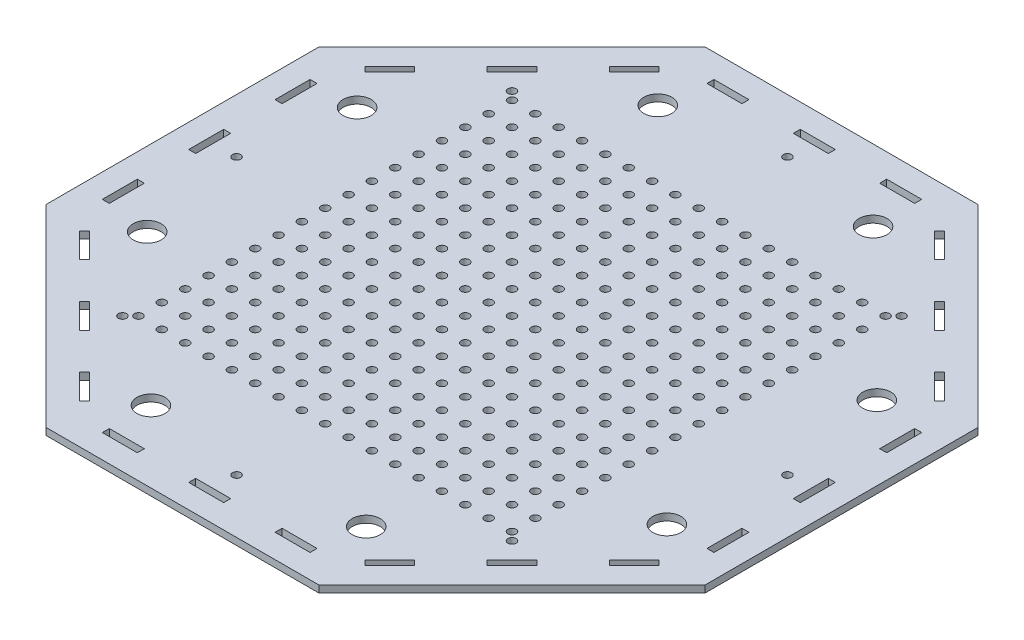
from build123d import *

# Parameters (mm, degrees)
EXTRUDE_1_DEPTH      = 1.5
EXTRUDE_1_DEPTH_BACK = 1.5
SKETCH_1_R           = 1.75
SKETCH_1_W           = 15
SKETCH_1_H           = 3
SKETCH_1_R_2         = 6
SKETCH_1_W_2         = 3
SKETCH_1_H_2         = 15


with BuildPart() as part:
    # Эскиз1 → Бобышка-Вытянуть1 (new, two sides: drawn at the far end of the back side and taken through both)
    with BuildSketch(Plane(origin=(0, 0, 0), x_dir=(1, 0, 0), z_dir=(0, 1, 0)).offset(-EXTRUDE_1_DEPTH_BACK)):
        Polygon((58.465821511, -141.148979228), (141.148979228, -58.465821511), (141.148979228, 58.465821511), (58.465821511, 141.148979228), (-58.465821511, 141.148979228), (-141.148979228, 58.465821511), (-141.148979228, -58.465821511), (-58.465821511, -141.148979228), align=None)
        Polygon((-95.812968851, -85.206367133), (-85.206367133, -95.812968851), (-87.327687476, -97.934289194), (-97.934289194, -87.327687476), (-96.873629023, -86.267027305), align=None, mode=Mode.SUBTRACT)
        with Locations((-83.43860018, -83.43860018)):
            Circle(SKETCH_1_R, mode=Mode.SUBTRACT)
        with Locations((-80, -80)):
            Circle(SKETCH_1_R, mode=Mode.SUBTRACT)
        with Locations((-37, -129.5)):
            Rectangle(SKETCH_1_W, SKETCH_1_H, mode=Mode.SUBTRACT)
        Polygon((-69.650017947, -111.369318037), (-59.043416229, -121.975919755), (-61.164736573, -124.097240098), (-71.771338291, -113.49063838), align=None, mode=Mode.SUBTRACT)
        with Locations((-44.154662613, -110.505048615)):
            Circle(SKETCH_1_R_2, mode=Mode.SUBTRACT)
        with Locations((-70, -80)):
            Circle(SKETCH_1_R, mode=Mode.SUBTRACT)
        with Locations((-60, -80)):
            Circle(SKETCH_1_R, mode=Mode.SUBTRACT)
        with Locations((-50, -80)):
            Circle(SKETCH_1_R, mode=Mode.SUBTRACT)
        with Locations((-40, -80)):
            Circle(SKETCH_1_R, mode=Mode.SUBTRACT)
        with Locations((-30, -80)):
            Circle(SKETCH_1_R, mode=Mode.SUBTRACT)
        with Locations((-20, -80)):
            Circle(SKETCH_1_R, mode=Mode.SUBTRACT)
        with Locations((-10, -80)):
            Circle(SKETCH_1_R, mode=Mode.SUBTRACT)
        Polygon((-124.097240098, -61.164736573), (-121.975919755, -59.043416229), (-111.369318037, -69.650017947), (-113.49063838, -71.771338291), align=None, mode=Mode.SUBTRACT)
        with Locations((-129.5, -37)):
            Rectangle(SKETCH_1_W_2, SKETCH_1_H_2, mode=Mode.SUBTRACT)
        with Locations((-109.360930586, -46.916807876)):
            Circle(SKETCH_1_R_2, mode=Mode.SUBTRACT)
        with Locations((-80, -70)):
            Circle(SKETCH_1_R, mode=Mode.SUBTRACT)
        with Locations((-80, -60)):
            Circle(SKETCH_1_R, mode=Mode.SUBTRACT)
        with Locations((-80, -50)):
            Circle(SKETCH_1_R, mode=Mode.SUBTRACT)
        with Locations((-80, -40)):
            Circle(SKETCH_1_R, mode=Mode.SUBTRACT)
        Polygon((-128, 7.5), (-128, -7.5), (-131, -7.5), (-131, 7.5), (-129.5, 7.5), align=None, mode=Mode.SUBTRACT)
        with Locations((-118, 0)):
            Circle(SKETCH_1_R, mode=Mode.SUBTRACT)
        with Locations((-80, -30)):
            Circle(SKETCH_1_R, mode=Mode.SUBTRACT)
        with Locations((-80, -20)):
            Circle(SKETCH_1_R, mode=Mode.SUBTRACT)
        with Locations((-80, -10)):
            Circle(SKETCH_1_R, mode=Mode.SUBTRACT)
        with Locations((-80, 0)):
            Circle(SKETCH_1_R, mode=Mode.SUBTRACT)
        with Locations((-70, -70)):
            Circle(SKETCH_1_R, mode=Mode.SUBTRACT)
        with Locations((-60, -70)):
            Circle(SKETCH_1_R, mode=Mode.SUBTRACT)
        with Locations((-70, -60)):
            Circle(SKETCH_1_R, mode=Mode.SUBTRACT)
        with Locations((-60, -60)):
            Circle(SKETCH_1_R, mode=Mode.SUBTRACT)
        with Locations((-50, -70)):
            Circle(SKETCH_1_R, mode=Mode.SUBTRACT)
        with Locations((-40, -70)):
            Circle(SKETCH_1_R, mode=Mode.SUBTRACT)
        with Locations((-50, -60)):
            Circle(SKETCH_1_R, mode=Mode.SUBTRACT)
        with Locations((-40, -60)):
            Circle(SKETCH_1_R, mode=Mode.SUBTRACT)
        with Locations((-70, -50)):
            Circle(SKETCH_1_R, mode=Mode.SUBTRACT)
        with Locations((-60, -50)):
            Circle(SKETCH_1_R, mode=Mode.SUBTRACT)
        with Locations((-70, -40)):
            Circle(SKETCH_1_R, mode=Mode.SUBTRACT)
        with Locations((-60, -40)):
            Circle(SKETCH_1_R, mode=Mode.SUBTRACT)
        with Locations((-50, -50)):
            Circle(SKETCH_1_R, mode=Mode.SUBTRACT)
        with Locations((-40, -50)):
            Circle(SKETCH_1_R, mode=Mode.SUBTRACT)
        with Locations((-50, -40)):
            Circle(SKETCH_1_R, mode=Mode.SUBTRACT)
        with Locations((-40, -40)):
            Circle(SKETCH_1_R, mode=Mode.SUBTRACT)
        with Locations((-30, -70)):
            Circle(SKETCH_1_R, mode=Mode.SUBTRACT)
        with Locations((-20, -70)):
            Circle(SKETCH_1_R, mode=Mode.SUBTRACT)
        with Locations((-30, -60)):
            Circle(SKETCH_1_R, mode=Mode.SUBTRACT)
        with Locations((-20, -60)):
            Circle(SKETCH_1_R, mode=Mode.SUBTRACT)
        with Locations((-10, -70)):
            Circle(SKETCH_1_R, mode=Mode.SUBTRACT)
        with Locations((-10, -60)):
            Circle(SKETCH_1_R, mode=Mode.SUBTRACT)
        with Locations((-30, -50)):
            Circle(SKETCH_1_R, mode=Mode.SUBTRACT)
        with Locations((-20, -50)):
            Circle(SKETCH_1_R, mode=Mode.SUBTRACT)
        with Locations((-30, -40)):
            Circle(SKETCH_1_R, mode=Mode.SUBTRACT)
        with Locations((-20, -40)):
            Circle(SKETCH_1_R, mode=Mode.SUBTRACT)
        with Locations((-10, -50)):
            Circle(SKETCH_1_R, mode=Mode.SUBTRACT)
        with Locations((-10, -40)):
            Circle(SKETCH_1_R, mode=Mode.SUBTRACT)
        with Locations((-70, -30)):
            Circle(SKETCH_1_R, mode=Mode.SUBTRACT)
        with Locations((-60, -30)):
            Circle(SKETCH_1_R, mode=Mode.SUBTRACT)
        with Locations((-70, -20)):
            Circle(SKETCH_1_R, mode=Mode.SUBTRACT)
        with Locations((-60, -20)):
            Circle(SKETCH_1_R, mode=Mode.SUBTRACT)
        with Locations((-50, -30)):
            Circle(SKETCH_1_R, mode=Mode.SUBTRACT)
        with Locations((-40, -30)):
            Circle(SKETCH_1_R, mode=Mode.SUBTRACT)
        with Locations((-50, -20)):
            Circle(SKETCH_1_R, mode=Mode.SUBTRACT)
        with Locations((-40, -20)):
            Circle(SKETCH_1_R, mode=Mode.SUBTRACT)
        with Locations((-70, -10)):
            Circle(SKETCH_1_R, mode=Mode.SUBTRACT)
        with Locations((-60, -10)):
            Circle(SKETCH_1_R, mode=Mode.SUBTRACT)
        with Locations((-70, 0)):
            Circle(SKETCH_1_R, mode=Mode.SUBTRACT)
        with Locations((-60, 0)):
            Circle(SKETCH_1_R, mode=Mode.SUBTRACT)
        with Locations((-50, -10)):
            Circle(SKETCH_1_R, mode=Mode.SUBTRACT)
        with Locations((-40, -10)):
            Circle(SKETCH_1_R, mode=Mode.SUBTRACT)
        with Locations((-50, 0)):
            Circle(SKETCH_1_R, mode=Mode.SUBTRACT)
        with Locations((-40, 0)):
            Circle(SKETCH_1_R, mode=Mode.SUBTRACT)
        with Locations((-30, -30)):
            Circle(SKETCH_1_R, mode=Mode.SUBTRACT)
        with Locations((-20, -30)):
            Circle(SKETCH_1_R, mode=Mode.SUBTRACT)
        with Locations((-30, -20)):
            Circle(SKETCH_1_R, mode=Mode.SUBTRACT)
        with Locations((-20, -20)):
            Circle(SKETCH_1_R, mode=Mode.SUBTRACT)
        with Locations((-10, -30)):
            Circle(SKETCH_1_R, mode=Mode.SUBTRACT)
        with Locations((-10, -20)):
            Circle(SKETCH_1_R, mode=Mode.SUBTRACT)
        with Locations((-30, -10)):
            Circle(SKETCH_1_R, mode=Mode.SUBTRACT)
        with Locations((-20, -10)):
            Circle(SKETCH_1_R, mode=Mode.SUBTRACT)
        with Locations((-30, 0)):
            Circle(SKETCH_1_R, mode=Mode.SUBTRACT)
        with Locations((-20, 0)):
            Circle(SKETCH_1_R, mode=Mode.SUBTRACT)
        with Locations((-10, -10)):
            Circle(SKETCH_1_R, mode=Mode.SUBTRACT)
        with Locations((-10, 0)):
            Circle(SKETCH_1_R, mode=Mode.SUBTRACT)
        Polygon((-7.5, -128), (7.5, -128), (7.5, -131), (-7.5, -131), (-7.5, -129.5), align=None, mode=Mode.SUBTRACT)
        with Locations((0, -118)):
            Circle(SKETCH_1_R, mode=Mode.SUBTRACT)
        with Locations((37, -129.5)):
            Rectangle(SKETCH_1_W, SKETCH_1_H, mode=Mode.SUBTRACT)
        with Locations((46.916807876, -109.360930586)):
            Circle(SKETCH_1_R_2, mode=Mode.SUBTRACT)
        Polygon((61.164736573, -124.097240098), (59.043416229, -121.975919755), (69.650017947, -111.369318037), (71.771338291, -113.49063838), align=None, mode=Mode.SUBTRACT)
        with Locations((0, -80)):
            Circle(SKETCH_1_R, mode=Mode.SUBTRACT)
        with Locations((10, -80)):
            Circle(SKETCH_1_R, mode=Mode.SUBTRACT)
        with Locations((20, -80)):
            Circle(SKETCH_1_R, mode=Mode.SUBTRACT)
        with Locations((30, -80)):
            Circle(SKETCH_1_R, mode=Mode.SUBTRACT)
        with Locations((40, -80)):
            Circle(SKETCH_1_R, mode=Mode.SUBTRACT)
        with Locations((50, -80)):
            Circle(SKETCH_1_R, mode=Mode.SUBTRACT)
        with Locations((60, -80)):
            Circle(SKETCH_1_R, mode=Mode.SUBTRACT)
        with Locations((70, -80)):
            Circle(SKETCH_1_R, mode=Mode.SUBTRACT)
        Polygon((85.206367133, -95.812968851), (95.812968851, -85.206367133), (97.934289194, -87.327687476), (87.327687476, -97.934289194), (86.267027305, -96.873629023), align=None, mode=Mode.SUBTRACT)
        with Locations((83.43860018, -83.43860018)):
            Circle(SKETCH_1_R, mode=Mode.SUBTRACT)
        with Locations((80, -80)):
            Circle(SKETCH_1_R, mode=Mode.SUBTRACT)
        with Locations((0, -70)):
            Circle(SKETCH_1_R, mode=Mode.SUBTRACT)
        with Locations((10, -70)):
            Circle(SKETCH_1_R, mode=Mode.SUBTRACT)
        with Locations((0, -60)):
            Circle(SKETCH_1_R, mode=Mode.SUBTRACT)
        with Locations((10, -60)):
            Circle(SKETCH_1_R, mode=Mode.SUBTRACT)
        with Locations((20, -70)):
            Circle(SKETCH_1_R, mode=Mode.SUBTRACT)
        with Locations((30, -70)):
            Circle(SKETCH_1_R, mode=Mode.SUBTRACT)
        with Locations((20, -60)):
            Circle(SKETCH_1_R, mode=Mode.SUBTRACT)
        with Locations((30, -60)):
            Circle(SKETCH_1_R, mode=Mode.SUBTRACT)
        with Locations((0, -50)):
            Circle(SKETCH_1_R, mode=Mode.SUBTRACT)
        with Locations((10, -50)):
            Circle(SKETCH_1_R, mode=Mode.SUBTRACT)
        with Locations((0, -40)):
            Circle(SKETCH_1_R, mode=Mode.SUBTRACT)
        with Locations((10, -40)):
            Circle(SKETCH_1_R, mode=Mode.SUBTRACT)
        with Locations((20, -50)):
            Circle(SKETCH_1_R, mode=Mode.SUBTRACT)
        with Locations((30, -50)):
            Circle(SKETCH_1_R, mode=Mode.SUBTRACT)
        with Locations((20, -40)):
            Circle(SKETCH_1_R, mode=Mode.SUBTRACT)
        with Locations((30, -40)):
            Circle(SKETCH_1_R, mode=Mode.SUBTRACT)
        with Locations((40, -70)):
            Circle(SKETCH_1_R, mode=Mode.SUBTRACT)
        with Locations((50, -70)):
            Circle(SKETCH_1_R, mode=Mode.SUBTRACT)
        with Locations((40, -60)):
            Circle(SKETCH_1_R, mode=Mode.SUBTRACT)
        with Locations((50, -60)):
            Circle(SKETCH_1_R, mode=Mode.SUBTRACT)
        with Locations((60, -70)):
            Circle(SKETCH_1_R, mode=Mode.SUBTRACT)
        with Locations((70, -70)):
            Circle(SKETCH_1_R, mode=Mode.SUBTRACT)
        with Locations((60, -60)):
            Circle(SKETCH_1_R, mode=Mode.SUBTRACT)
        with Locations((70, -60)):
            Circle(SKETCH_1_R, mode=Mode.SUBTRACT)
        with Locations((40, -50)):
            Circle(SKETCH_1_R, mode=Mode.SUBTRACT)
        with Locations((50, -50)):
            Circle(SKETCH_1_R, mode=Mode.SUBTRACT)
        with Locations((40, -40)):
            Circle(SKETCH_1_R, mode=Mode.SUBTRACT)
        with Locations((50, -40)):
            Circle(SKETCH_1_R, mode=Mode.SUBTRACT)
        with Locations((60, -50)):
            Circle(SKETCH_1_R, mode=Mode.SUBTRACT)
        with Locations((70, -50)):
            Circle(SKETCH_1_R, mode=Mode.SUBTRACT)
        with Locations((60, -40)):
            Circle(SKETCH_1_R, mode=Mode.SUBTRACT)
        with Locations((70, -40)):
            Circle(SKETCH_1_R, mode=Mode.SUBTRACT)
        with Locations((0, -30)):
            Circle(SKETCH_1_R, mode=Mode.SUBTRACT)
        with Locations((10, -30)):
            Circle(SKETCH_1_R, mode=Mode.SUBTRACT)
        with Locations((0, -20)):
            Circle(SKETCH_1_R, mode=Mode.SUBTRACT)
        with Locations((10, -20)):
            Circle(SKETCH_1_R, mode=Mode.SUBTRACT)
        with Locations((20, -30)):
            Circle(SKETCH_1_R, mode=Mode.SUBTRACT)
        with Locations((30, -30)):
            Circle(SKETCH_1_R, mode=Mode.SUBTRACT)
        with Locations((20, -20)):
            Circle(SKETCH_1_R, mode=Mode.SUBTRACT)
        with Locations((30, -20)):
            Circle(SKETCH_1_R, mode=Mode.SUBTRACT)
        with Locations((0, -10)):
            Circle(SKETCH_1_R, mode=Mode.SUBTRACT)
        with Locations((10, -10)):
            Circle(SKETCH_1_R, mode=Mode.SUBTRACT)
        with Locations((20, -10)):
            Circle(SKETCH_1_R, mode=Mode.SUBTRACT)
        with Locations((30, -10)):
            Circle(SKETCH_1_R, mode=Mode.SUBTRACT)
        with Locations((40, -30)):
            Circle(SKETCH_1_R, mode=Mode.SUBTRACT)
        with Locations((50, -30)):
            Circle(SKETCH_1_R, mode=Mode.SUBTRACT)
        with Locations((40, -20)):
            Circle(SKETCH_1_R, mode=Mode.SUBTRACT)
        with Locations((50, -20)):
            Circle(SKETCH_1_R, mode=Mode.SUBTRACT)
        with Locations((60, -30)):
            Circle(SKETCH_1_R, mode=Mode.SUBTRACT)
        with Locations((70, -30)):
            Circle(SKETCH_1_R, mode=Mode.SUBTRACT)
        with Locations((60, -20)):
            Circle(SKETCH_1_R, mode=Mode.SUBTRACT)
        with Locations((70, -20)):
            Circle(SKETCH_1_R, mode=Mode.SUBTRACT)
        with Locations((40, -10)):
            Circle(SKETCH_1_R, mode=Mode.SUBTRACT)
        with Locations((50, -10)):
            Circle(SKETCH_1_R, mode=Mode.SUBTRACT)
        with Locations((60, -10)):
            Circle(SKETCH_1_R, mode=Mode.SUBTRACT)
        with Locations((70, -10)):
            Circle(SKETCH_1_R, mode=Mode.SUBTRACT)
        with Locations((80, -70)):
            Circle(SKETCH_1_R, mode=Mode.SUBTRACT)
        with Locations((80, -60)):
            Circle(SKETCH_1_R, mode=Mode.SUBTRACT)
        with Locations((80, -50)):
            Circle(SKETCH_1_R, mode=Mode.SUBTRACT)
        with Locations((80, -40)):
            Circle(SKETCH_1_R, mode=Mode.SUBTRACT)
        Polygon((111.369318037, -69.650017947), (121.975919755, -59.043416229), (124.097240098, -61.164736573), (113.49063838, -71.771338291), align=None, mode=Mode.SUBTRACT)
        with Locations((110.505048615, -44.154662613)):
            Circle(SKETCH_1_R_2, mode=Mode.SUBTRACT)
        with Locations((129.5, -37)):
            Rectangle(SKETCH_1_W_2, SKETCH_1_H_2, mode=Mode.SUBTRACT)
        with Locations((80, -30)):
            Circle(SKETCH_1_R, mode=Mode.SUBTRACT)
        with Locations((80, -20)):
            Circle(SKETCH_1_R, mode=Mode.SUBTRACT)
        with Locations((80, -10)):
            Circle(SKETCH_1_R, mode=Mode.SUBTRACT)
        with Locations((-80, 10)):
            Circle(SKETCH_1_R, mode=Mode.SUBTRACT)
        with Locations((-80, 20)):
            Circle(SKETCH_1_R, mode=Mode.SUBTRACT)
        with Locations((-80, 30)):
            Circle(SKETCH_1_R, mode=Mode.SUBTRACT)
        with Locations((-129.5, 37)):
            Rectangle(SKETCH_1_W_2, SKETCH_1_H_2, mode=Mode.SUBTRACT)
        with Locations((-110.505048615, 44.154662613)):
            Circle(SKETCH_1_R_2, mode=Mode.SUBTRACT)
        Polygon((-111.369318037, 69.650017947), (-121.975919755, 59.043416229), (-124.097240098, 61.164736573), (-113.49063838, 71.771338291), align=None, mode=Mode.SUBTRACT)
        with Locations((-80, 40)):
            Circle(SKETCH_1_R, mode=Mode.SUBTRACT)
        with Locations((-80, 50)):
            Circle(SKETCH_1_R, mode=Mode.SUBTRACT)
        with Locations((-80, 60)):
            Circle(SKETCH_1_R, mode=Mode.SUBTRACT)
        with Locations((-80, 70)):
            Circle(SKETCH_1_R, mode=Mode.SUBTRACT)
        with Locations((-70, 10)):
            Circle(SKETCH_1_R, mode=Mode.SUBTRACT)
        with Locations((-60, 10)):
            Circle(SKETCH_1_R, mode=Mode.SUBTRACT)
        with Locations((-50, 10)):
            Circle(SKETCH_1_R, mode=Mode.SUBTRACT)
        with Locations((-40, 10)):
            Circle(SKETCH_1_R, mode=Mode.SUBTRACT)
        with Locations((-70, 20)):
            Circle(SKETCH_1_R, mode=Mode.SUBTRACT)
        with Locations((-60, 20)):
            Circle(SKETCH_1_R, mode=Mode.SUBTRACT)
        with Locations((-70, 30)):
            Circle(SKETCH_1_R, mode=Mode.SUBTRACT)
        with Locations((-60, 30)):
            Circle(SKETCH_1_R, mode=Mode.SUBTRACT)
        with Locations((-50, 20)):
            Circle(SKETCH_1_R, mode=Mode.SUBTRACT)
        with Locations((-40, 20)):
            Circle(SKETCH_1_R, mode=Mode.SUBTRACT)
        with Locations((-50, 30)):
            Circle(SKETCH_1_R, mode=Mode.SUBTRACT)
        with Locations((-40, 30)):
            Circle(SKETCH_1_R, mode=Mode.SUBTRACT)
        with Locations((-30, 10)):
            Circle(SKETCH_1_R, mode=Mode.SUBTRACT)
        with Locations((-20, 10)):
            Circle(SKETCH_1_R, mode=Mode.SUBTRACT)
        Circle(SKETCH_1_R, mode=Mode.SUBTRACT)
        with Locations((-10, 10)):
            Circle(SKETCH_1_R, mode=Mode.SUBTRACT)
        with Locations((0, 10)):
            Circle(SKETCH_1_R, mode=Mode.SUBTRACT)
        with Locations((-30, 20)):
            Circle(SKETCH_1_R, mode=Mode.SUBTRACT)
        with Locations((-20, 20)):
            Circle(SKETCH_1_R, mode=Mode.SUBTRACT)
        with Locations((-30, 30)):
            Circle(SKETCH_1_R, mode=Mode.SUBTRACT)
        with Locations((-20, 30)):
            Circle(SKETCH_1_R, mode=Mode.SUBTRACT)
        with Locations((-10, 20)):
            Circle(SKETCH_1_R, mode=Mode.SUBTRACT)
        with Locations((0, 20)):
            Circle(SKETCH_1_R, mode=Mode.SUBTRACT)
        with Locations((-10, 30)):
            Circle(SKETCH_1_R, mode=Mode.SUBTRACT)
        with Locations((0, 30)):
            Circle(SKETCH_1_R, mode=Mode.SUBTRACT)
        with Locations((-70, 40)):
            Circle(SKETCH_1_R, mode=Mode.SUBTRACT)
        with Locations((-60, 40)):
            Circle(SKETCH_1_R, mode=Mode.SUBTRACT)
        with Locations((-70, 50)):
            Circle(SKETCH_1_R, mode=Mode.SUBTRACT)
        with Locations((-60, 50)):
            Circle(SKETCH_1_R, mode=Mode.SUBTRACT)
        with Locations((-50, 40)):
            Circle(SKETCH_1_R, mode=Mode.SUBTRACT)
        with Locations((-40, 40)):
            Circle(SKETCH_1_R, mode=Mode.SUBTRACT)
        with Locations((-50, 50)):
            Circle(SKETCH_1_R, mode=Mode.SUBTRACT)
        with Locations((-40, 50)):
            Circle(SKETCH_1_R, mode=Mode.SUBTRACT)
        with Locations((-70, 60)):
            Circle(SKETCH_1_R, mode=Mode.SUBTRACT)
        with Locations((-60, 60)):
            Circle(SKETCH_1_R, mode=Mode.SUBTRACT)
        with Locations((-70, 70)):
            Circle(SKETCH_1_R, mode=Mode.SUBTRACT)
        with Locations((-60, 70)):
            Circle(SKETCH_1_R, mode=Mode.SUBTRACT)
        with Locations((-50, 60)):
            Circle(SKETCH_1_R, mode=Mode.SUBTRACT)
        with Locations((-40, 60)):
            Circle(SKETCH_1_R, mode=Mode.SUBTRACT)
        with Locations((-50, 70)):
            Circle(SKETCH_1_R, mode=Mode.SUBTRACT)
        with Locations((-40, 70)):
            Circle(SKETCH_1_R, mode=Mode.SUBTRACT)
        with Locations((-30, 40)):
            Circle(SKETCH_1_R, mode=Mode.SUBTRACT)
        with Locations((-20, 40)):
            Circle(SKETCH_1_R, mode=Mode.SUBTRACT)
        with Locations((-30, 50)):
            Circle(SKETCH_1_R, mode=Mode.SUBTRACT)
        with Locations((-20, 50)):
            Circle(SKETCH_1_R, mode=Mode.SUBTRACT)
        with Locations((-10, 40)):
            Circle(SKETCH_1_R, mode=Mode.SUBTRACT)
        with Locations((0, 40)):
            Circle(SKETCH_1_R, mode=Mode.SUBTRACT)
        with Locations((-10, 50)):
            Circle(SKETCH_1_R, mode=Mode.SUBTRACT)
        with Locations((0, 50)):
            Circle(SKETCH_1_R, mode=Mode.SUBTRACT)
        with Locations((-30, 60)):
            Circle(SKETCH_1_R, mode=Mode.SUBTRACT)
        with Locations((-20, 60)):
            Circle(SKETCH_1_R, mode=Mode.SUBTRACT)
        with Locations((-30, 70)):
            Circle(SKETCH_1_R, mode=Mode.SUBTRACT)
        with Locations((-20, 70)):
            Circle(SKETCH_1_R, mode=Mode.SUBTRACT)
        with Locations((-10, 60)):
            Circle(SKETCH_1_R, mode=Mode.SUBTRACT)
        with Locations((0, 60)):
            Circle(SKETCH_1_R, mode=Mode.SUBTRACT)
        with Locations((-10, 70)):
            Circle(SKETCH_1_R, mode=Mode.SUBTRACT)
        with Locations((0, 70)):
            Circle(SKETCH_1_R, mode=Mode.SUBTRACT)
        with Locations((-80, 80)):
            Circle(SKETCH_1_R, mode=Mode.SUBTRACT)
        with Locations((-83.43860018, 83.43860018)):
            Circle(SKETCH_1_R, mode=Mode.SUBTRACT)
        Polygon((-85.206367133, 95.812968851), (-95.812968851, 85.206367133), (-97.934289194, 87.327687476), (-87.327687476, 97.934289194), (-86.267027305, 96.873629023), align=None, mode=Mode.SUBTRACT)
        with Locations((-70, 80)):
            Circle(SKETCH_1_R, mode=Mode.SUBTRACT)
        with Locations((-60, 80)):
            Circle(SKETCH_1_R, mode=Mode.SUBTRACT)
        with Locations((-50, 80)):
            Circle(SKETCH_1_R, mode=Mode.SUBTRACT)
        with Locations((-40, 80)):
            Circle(SKETCH_1_R, mode=Mode.SUBTRACT)
        with Locations((-30, 80)):
            Circle(SKETCH_1_R, mode=Mode.SUBTRACT)
        with Locations((-20, 80)):
            Circle(SKETCH_1_R, mode=Mode.SUBTRACT)
        with Locations((-10, 80)):
            Circle(SKETCH_1_R, mode=Mode.SUBTRACT)
        with Locations((0, 80)):
            Circle(SKETCH_1_R, mode=Mode.SUBTRACT)
        Polygon((-61.164736573, 124.097240098), (-59.043416229, 121.975919755), (-69.650017947, 111.369318037), (-71.771338291, 113.49063838), align=None, mode=Mode.SUBTRACT)
        with Locations((-46.916807876, 109.360930586)):
            Circle(SKETCH_1_R_2, mode=Mode.SUBTRACT)
        with Locations((-37, 129.5)):
            Rectangle(SKETCH_1_W, SKETCH_1_H, mode=Mode.SUBTRACT)
        with Locations((0, 118)):
            Circle(SKETCH_1_R, mode=Mode.SUBTRACT)
        Polygon((7.5, 128), (-7.5, 128), (-7.5, 131), (7.5, 131), (7.5, 129.5), align=None, mode=Mode.SUBTRACT)
        with Locations((10, 0)):
            Circle(SKETCH_1_R, mode=Mode.SUBTRACT)
        with Locations((10, 10)):
            Circle(SKETCH_1_R, mode=Mode.SUBTRACT)
        with Locations((20, 0)):
            Circle(SKETCH_1_R, mode=Mode.SUBTRACT)
        with Locations((30, 0)):
            Circle(SKETCH_1_R, mode=Mode.SUBTRACT)
        with Locations((20, 10)):
            Circle(SKETCH_1_R, mode=Mode.SUBTRACT)
        with Locations((30, 10)):
            Circle(SKETCH_1_R, mode=Mode.SUBTRACT)
        with Locations((10, 20)):
            Circle(SKETCH_1_R, mode=Mode.SUBTRACT)
        with Locations((10, 30)):
            Circle(SKETCH_1_R, mode=Mode.SUBTRACT)
        with Locations((20, 20)):
            Circle(SKETCH_1_R, mode=Mode.SUBTRACT)
        with Locations((30, 20)):
            Circle(SKETCH_1_R, mode=Mode.SUBTRACT)
        with Locations((20, 30)):
            Circle(SKETCH_1_R, mode=Mode.SUBTRACT)
        with Locations((30, 30)):
            Circle(SKETCH_1_R, mode=Mode.SUBTRACT)
        with Locations((40, 0)):
            Circle(SKETCH_1_R, mode=Mode.SUBTRACT)
        with Locations((50, 0)):
            Circle(SKETCH_1_R, mode=Mode.SUBTRACT)
        with Locations((40, 10)):
            Circle(SKETCH_1_R, mode=Mode.SUBTRACT)
        with Locations((50, 10)):
            Circle(SKETCH_1_R, mode=Mode.SUBTRACT)
        with Locations((60, 0)):
            Circle(SKETCH_1_R, mode=Mode.SUBTRACT)
        with Locations((70, 0)):
            Circle(SKETCH_1_R, mode=Mode.SUBTRACT)
        with Locations((60, 10)):
            Circle(SKETCH_1_R, mode=Mode.SUBTRACT)
        with Locations((70, 10)):
            Circle(SKETCH_1_R, mode=Mode.SUBTRACT)
        with Locations((40, 20)):
            Circle(SKETCH_1_R, mode=Mode.SUBTRACT)
        with Locations((50, 20)):
            Circle(SKETCH_1_R, mode=Mode.SUBTRACT)
        with Locations((40, 30)):
            Circle(SKETCH_1_R, mode=Mode.SUBTRACT)
        with Locations((50, 30)):
            Circle(SKETCH_1_R, mode=Mode.SUBTRACT)
        with Locations((60, 20)):
            Circle(SKETCH_1_R, mode=Mode.SUBTRACT)
        with Locations((70, 20)):
            Circle(SKETCH_1_R, mode=Mode.SUBTRACT)
        with Locations((60, 30)):
            Circle(SKETCH_1_R, mode=Mode.SUBTRACT)
        with Locations((70, 30)):
            Circle(SKETCH_1_R, mode=Mode.SUBTRACT)
        with Locations((10, 40)):
            Circle(SKETCH_1_R, mode=Mode.SUBTRACT)
        with Locations((10, 50)):
            Circle(SKETCH_1_R, mode=Mode.SUBTRACT)
        with Locations((20, 40)):
            Circle(SKETCH_1_R, mode=Mode.SUBTRACT)
        with Locations((30, 40)):
            Circle(SKETCH_1_R, mode=Mode.SUBTRACT)
        with Locations((20, 50)):
            Circle(SKETCH_1_R, mode=Mode.SUBTRACT)
        with Locations((30, 50)):
            Circle(SKETCH_1_R, mode=Mode.SUBTRACT)
        with Locations((10, 60)):
            Circle(SKETCH_1_R, mode=Mode.SUBTRACT)
        with Locations((10, 70)):
            Circle(SKETCH_1_R, mode=Mode.SUBTRACT)
        with Locations((20, 60)):
            Circle(SKETCH_1_R, mode=Mode.SUBTRACT)
        with Locations((30, 60)):
            Circle(SKETCH_1_R, mode=Mode.SUBTRACT)
        with Locations((20, 70)):
            Circle(SKETCH_1_R, mode=Mode.SUBTRACT)
        with Locations((30, 70)):
            Circle(SKETCH_1_R, mode=Mode.SUBTRACT)
        with Locations((40, 40)):
            Circle(SKETCH_1_R, mode=Mode.SUBTRACT)
        with Locations((50, 40)):
            Circle(SKETCH_1_R, mode=Mode.SUBTRACT)
        with Locations((40, 50)):
            Circle(SKETCH_1_R, mode=Mode.SUBTRACT)
        with Locations((50, 50)):
            Circle(SKETCH_1_R, mode=Mode.SUBTRACT)
        with Locations((60, 40)):
            Circle(SKETCH_1_R, mode=Mode.SUBTRACT)
        with Locations((70, 40)):
            Circle(SKETCH_1_R, mode=Mode.SUBTRACT)
        with Locations((60, 50)):
            Circle(SKETCH_1_R, mode=Mode.SUBTRACT)
        with Locations((70, 50)):
            Circle(SKETCH_1_R, mode=Mode.SUBTRACT)
        with Locations((40, 60)):
            Circle(SKETCH_1_R, mode=Mode.SUBTRACT)
        with Locations((50, 60)):
            Circle(SKETCH_1_R, mode=Mode.SUBTRACT)
        with Locations((40, 70)):
            Circle(SKETCH_1_R, mode=Mode.SUBTRACT)
        with Locations((50, 70)):
            Circle(SKETCH_1_R, mode=Mode.SUBTRACT)
        with Locations((60, 60)):
            Circle(SKETCH_1_R, mode=Mode.SUBTRACT)
        with Locations((70, 60)):
            Circle(SKETCH_1_R, mode=Mode.SUBTRACT)
        with Locations((60, 70)):
            Circle(SKETCH_1_R, mode=Mode.SUBTRACT)
        with Locations((70, 70)):
            Circle(SKETCH_1_R, mode=Mode.SUBTRACT)
        with Locations((80, 0)):
            Circle(SKETCH_1_R, mode=Mode.SUBTRACT)
        with Locations((80, 10)):
            Circle(SKETCH_1_R, mode=Mode.SUBTRACT)
        with Locations((80, 20)):
            Circle(SKETCH_1_R, mode=Mode.SUBTRACT)
        with Locations((80, 30)):
            Circle(SKETCH_1_R, mode=Mode.SUBTRACT)
        with Locations((118, 0)):
            Circle(SKETCH_1_R, mode=Mode.SUBTRACT)
        Polygon((128, -7.5), (128, 7.5), (131, 7.5), (131, -7.5), (129.5, -7.5), align=None, mode=Mode.SUBTRACT)
        with Locations((80, 40)):
            Circle(SKETCH_1_R, mode=Mode.SUBTRACT)
        with Locations((80, 50)):
            Circle(SKETCH_1_R, mode=Mode.SUBTRACT)
        with Locations((80, 60)):
            Circle(SKETCH_1_R, mode=Mode.SUBTRACT)
        with Locations((80, 70)):
            Circle(SKETCH_1_R, mode=Mode.SUBTRACT)
        with Locations((109.360930586, 46.916807876)):
            Circle(SKETCH_1_R_2, mode=Mode.SUBTRACT)
        with Locations((129.5, 37)):
            Rectangle(SKETCH_1_W_2, SKETCH_1_H_2, mode=Mode.SUBTRACT)
        Polygon((124.097240098, 61.164736573), (121.975919755, 59.043416229), (111.369318037, 69.650017947), (113.49063838, 71.771338291), align=None, mode=Mode.SUBTRACT)
        with Locations((10, 80)):
            Circle(SKETCH_1_R, mode=Mode.SUBTRACT)
        with Locations((20, 80)):
            Circle(SKETCH_1_R, mode=Mode.SUBTRACT)
        with Locations((30, 80)):
            Circle(SKETCH_1_R, mode=Mode.SUBTRACT)
        with Locations((40, 80)):
            Circle(SKETCH_1_R, mode=Mode.SUBTRACT)
        with Locations((50, 80)):
            Circle(SKETCH_1_R, mode=Mode.SUBTRACT)
        with Locations((60, 80)):
            Circle(SKETCH_1_R, mode=Mode.SUBTRACT)
        with Locations((70, 80)):
            Circle(SKETCH_1_R, mode=Mode.SUBTRACT)
        with Locations((44.154662613, 110.505048615)):
            Circle(SKETCH_1_R_2, mode=Mode.SUBTRACT)
        Polygon((69.650017947, 111.369318037), (59.043416229, 121.975919755), (61.164736573, 124.097240098), (71.771338291, 113.49063838), align=None, mode=Mode.SUBTRACT)
        with Locations((37, 129.5)):
            Rectangle(SKETCH_1_W, SKETCH_1_H, mode=Mode.SUBTRACT)
        with Locations((80, 80)):
            Circle(SKETCH_1_R, mode=Mode.SUBTRACT)
        with Locations((83.43860018, 83.43860018)):
            Circle(SKETCH_1_R, mode=Mode.SUBTRACT)
        Polygon((95.812968851, 85.206367133), (85.206367133, 95.812968851), (87.327687476, 97.934289194), (97.934289194, 87.327687476), (96.873629023, 86.267027305), align=None, mode=Mode.SUBTRACT)
    extrude(amount=EXTRUDE_1_DEPTH + EXTRUDE_1_DEPTH_BACK)


solid = part.part
